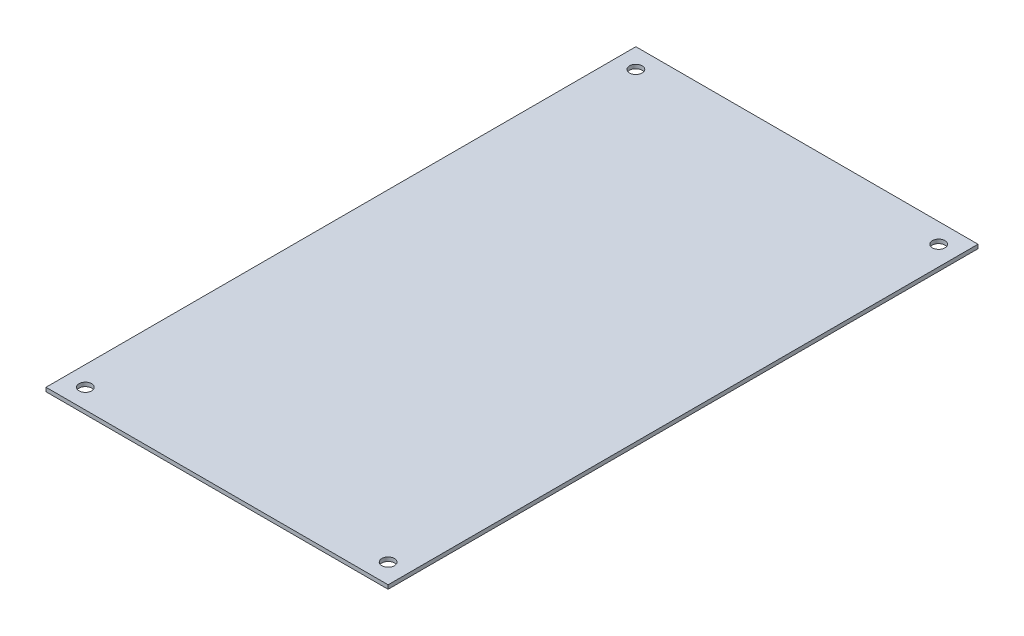
from build123d import *

# Parameters (mm, degrees)
SKETCH1_W           = 87
SKETCH1_H           = 150
SKETCH1_R           = 1.6
BOSS_EXTRUDE1_DEPTH = 1


with BuildPart() as part:
    # Sketch1 → Boss-Extrude1 (new body)
    with BuildSketch(Plane(origin=(0, 0, 0), x_dir=(1, 0, 0), z_dir=(0, 1, 0))):
        Rectangle(SKETCH1_W, SKETCH1_H)
        with Locations(Location((-38.5, 70, 0), (0, 0, 270))):
            Circle(SKETCH1_R, mode=Mode.SUBTRACT)
        with Locations(Location((38.5, 70, 0), (0, 0, 270))):
            Circle(SKETCH1_R, mode=Mode.SUBTRACT)
        with Locations(Location((38.5, -70, 0), (0, 0, 270))):
            Circle(SKETCH1_R, mode=Mode.SUBTRACT)
        with Locations(Location((-38.5, -70, 0), (0, 0, 270))):
            Circle(SKETCH1_R, mode=Mode.SUBTRACT)
    extrude(amount=BOSS_EXTRUDE1_DEPTH)


solid = part.part
